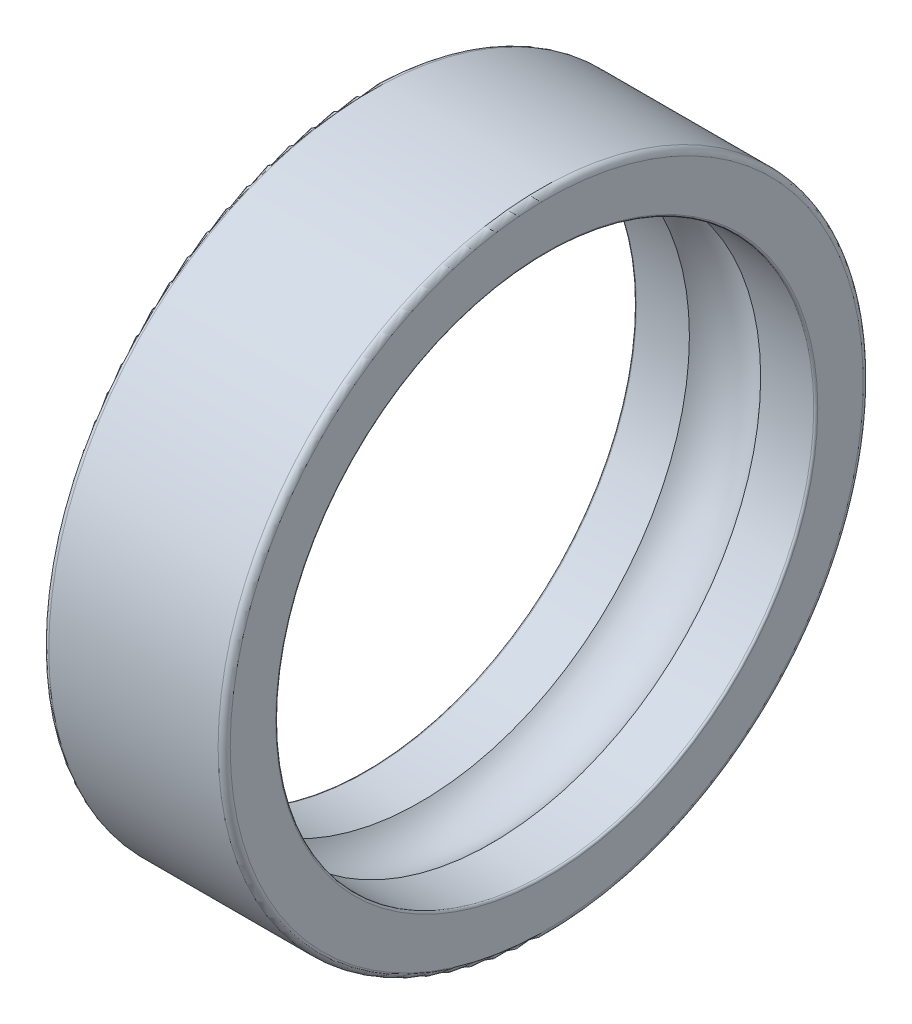
from build123d import *


with BuildPart() as part:
    # Esquisse1 → Révolution1 (revolve)
    with BuildSketch(Plane.XY, mode=Mode.PRIVATE) as r_volution1_sk:
        with BuildLine():
            Line((0, 15.7), (0, 13.445))
            ThreePointArc((0, 13.445), (0.029289322, 13.374289322), (0.1, 13.345))
            Line((0.1, 13.345), (2.732194581, 13.345))
            ThreePointArc((2.732194581, 13.345), (4.5, 14.131), (6.267805419, 13.345))
            Line((6.267805419, 13.345), (8.9, 13.345))
            ThreePointArc((8.9, 13.345), (8.970710678, 13.374289322), (9, 13.445))
            Line((9, 13.445), (9, 15.7))
            ThreePointArc((9, 15.7), (8.912132034, 15.912132034), (8.7, 16))
            Line((8.7, 16), (0.3, 16))
            ThreePointArc((0.3, 16), (0.087867966, 15.912132034), (0, 15.7))
        make_face()
    revolve(r_volution1_sk.sketch.rotate(Axis((50, 0, 0), (-1, 0, 0)), 270), axis=Axis((50, 0, 0), (-1, 0, 0)))


solid = part.part
